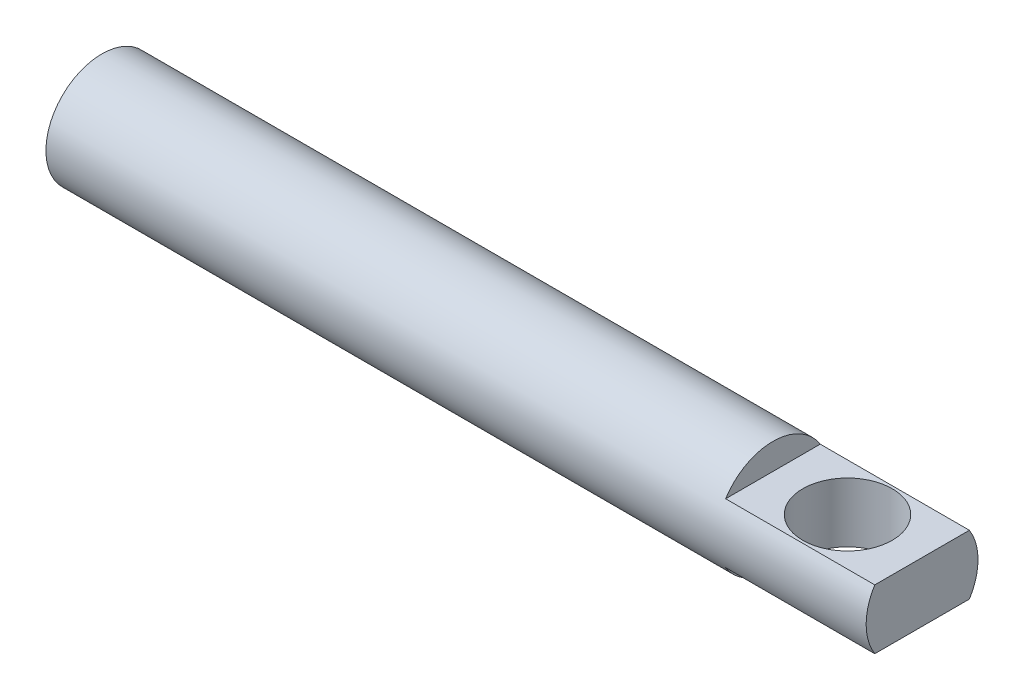
from build123d import *

# Parameters (mm, degrees)
SKETCH1_R           = 3.75
BOSS_EXTRUDE1_DEPTH = 45
BOSS_EXTRUDE2_DEPTH = 10
SKETCH3_R           = 3
CUT_EXTRUDE1_DEPTH  = 10


with BuildPart() as part:
    # Sketch1 → Boss-Extrude1 (new body)
    with BuildSketch(Plane(origin=(0, 0, 0), x_dir=(0, 0, -1), z_dir=(1, 0, 0))):
        with Locations(Location((0, 0, 0), (0, 0, 180))):
            Circle(SKETCH1_R)
    extrude(amount=BOSS_EXTRUDE1_DEPTH)

    # Sketch2 → Boss-Extrude2 (add)
    with BuildSketch(Plane(origin=(45, 0, 0), x_dir=(0, 0, -1), z_dir=(1, 0, 0))):
        with BuildLine():
            Line((3.172144385, 2), (0, 2))
            Line((0, 2), (-3.172144385, 2))
            ThreePointArc((-3.172144385, 2), (-3.75, 0), (-3.172144385, -2))
            Line((-3.172144385, -2), (3.172144385, -2))
            ThreePointArc((3.172144385, -2), (3.602640798, -1.040903107), (3.75, 0))
            ThreePointArc((3.75, 0), (3.602640798, 1.040903107), (3.172144385, 2))
        make_face()
    extrude(amount=BOSS_EXTRUDE2_DEPTH)

    # Sketch3 → Cut-Extrude1 (cut)
    with BuildSketch(Plane(origin=(0, 2, 0), x_dir=(1, 0, 0), z_dir=(0, 1, 0))):
        with Locations(Location((50, 0, 0), (0, 0, 270))):
            Circle(SKETCH3_R)
    extrude(amount=-CUT_EXTRUDE1_DEPTH, mode=Mode.SUBTRACT)


solid = part.part
